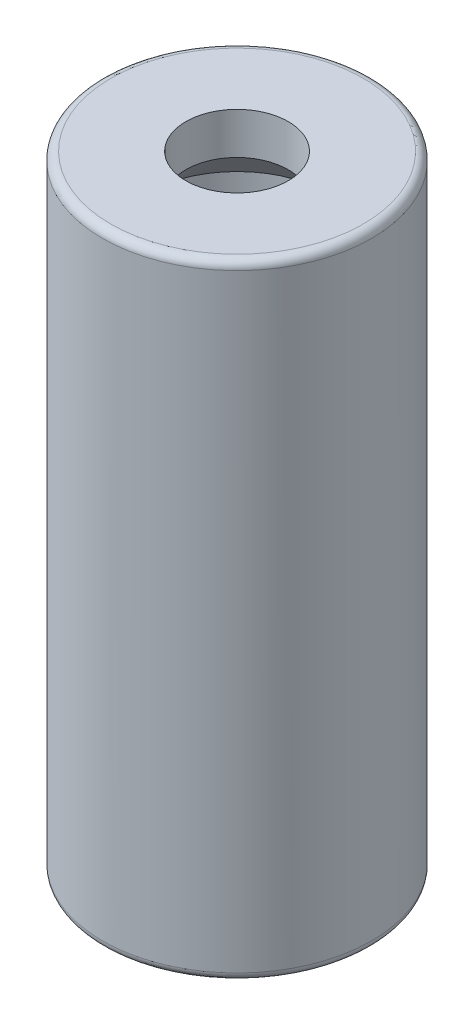
from build123d import *

# Parameters (mm, degrees)
SKETCH1_R           = 16.15
SKETCH1_R_2         = 11.15
BOSS_EXTRUDE1_DEPTH = 60
BOSS_EXTRUDE2_START = 5
SKETCH2_R           = 16.15
BOSS_EXTRUDE2_DEPTH = 5
FILLET1_R           = 1


with BuildPart() as part:
    # Sketch1 → Boss-Extrude1 (new body)
    with BuildSketch(Plane(origin=(0, 0, 0), x_dir=(1, 0, 0), z_dir=(0, 1, 0))):
        with Locations(Location((0, 0, 0), (0, 0, 270))):
            Circle(SKETCH1_R)
        with Locations(Location((0, 0, 0), (0, 0, 270))):
            Circle(SKETCH1_R_2, mode=Mode.SUBTRACT)
    extrude(amount=BOSS_EXTRUDE1_DEPTH)

    # Sketch2 → Boss-Extrude2 (add)
    with BuildSketch(Plane.XZ.offset(BOSS_EXTRUDE2_START)):
        with Locations(Location((0, 0, 0), (0, 0, 270))):
            Circle(SKETCH2_R)
    extrude(amount=-BOSS_EXTRUDE2_DEPTH)

    # Sketch3 → Revolve1 (revolve)
    with BuildSketch(Plane.XY, mode=Mode.PRIVATE) as revolve1_sk:
        Polygon((-11.15, 60), (-6.15, 65), (-6.15, 70), (-16.15, 70), (-16.15, 60), align=None)
    revolve(revolve1_sk.sketch.rotate(Axis((0, 60, 0), (0, -1, 0)), 270), axis=Axis((0, 60, 0), (0, -1, 0)))

    # Fillet1
    fillet1_edges = [part.edges().sort_by_distance(p)[0] for p in [
        (0, 70, -16.15),
        (0, -5, 16.15),
    ]]
    fillet(fillet1_edges, radius=FILLET1_R)


solid = part.part
